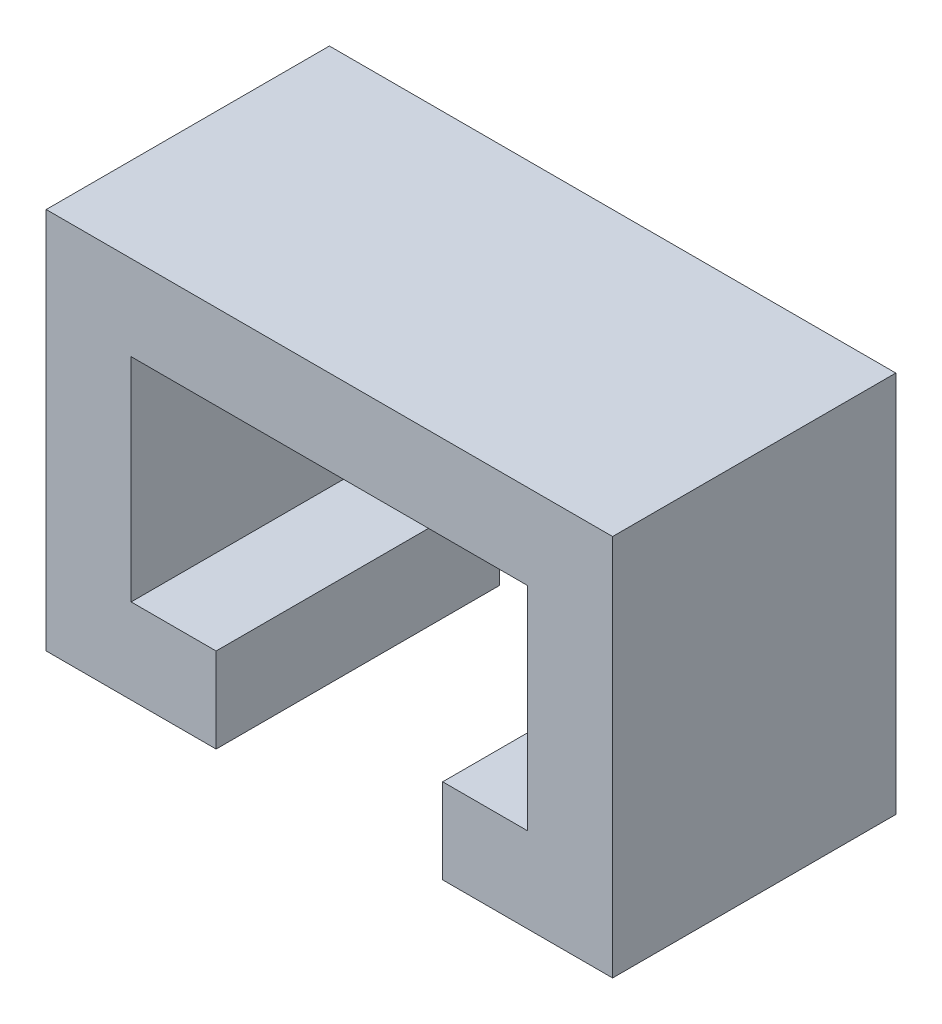
from build123d import *

# Parameters (mm, degrees)
BOSS_EXTRUDE1_DEPTH = 10


with BuildPart() as part:
    # Schizzo2 → Boss-Extrude1 (new body)
    with BuildSketch(Plane.XY):
        Polygon((-7, 0), (-7, 7.5), (7, 7.5), (7, 0), (4, 0), (4, -3), (10, -3), (10, 10.5), (-10, 10.5), (-10, -3), (-4, -3), (-4, 0), align=None)
    extrude(amount=BOSS_EXTRUDE1_DEPTH)


solid = part.part
